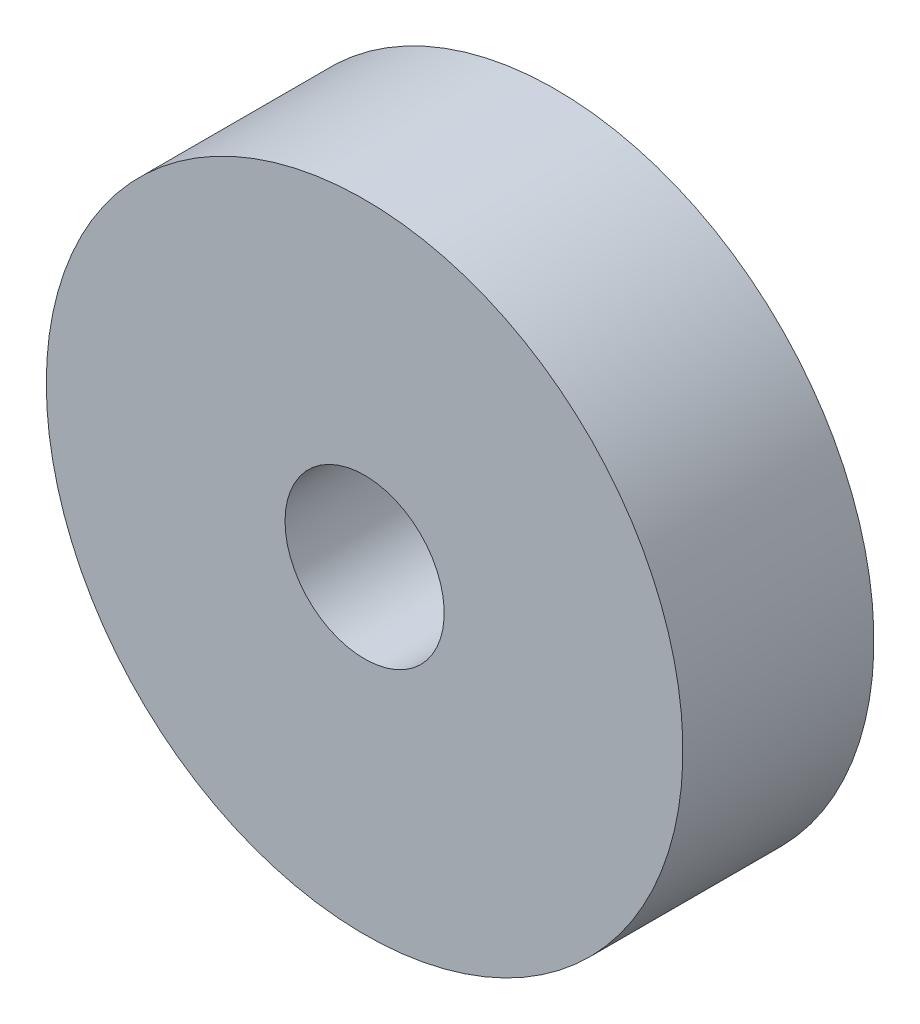
from build123d import *

# Parameters (mm, degrees)
SKETCH1_R           = 15.875
SKETCH1_R_2         = 3.96875
BOSS_EXTRUDE1_DEPTH = 9.525


with BuildPart() as part:
    # Sketch1 → Boss-Extrude1 (new body)
    with BuildSketch(Plane(origin=(0, 0, 0), x_dir=(0, 1, 0), z_dir=(0, 0, 1))):
        with Locations(Location((0, 0, 0), (0, 0, 90))):
            Circle(SKETCH1_R)
        with Locations(Location((0, 0, 0), (0, 0, 90))):
            Circle(SKETCH1_R_2, mode=Mode.SUBTRACT)
    extrude(amount=BOSS_EXTRUDE1_DEPTH)


solid = part.part
